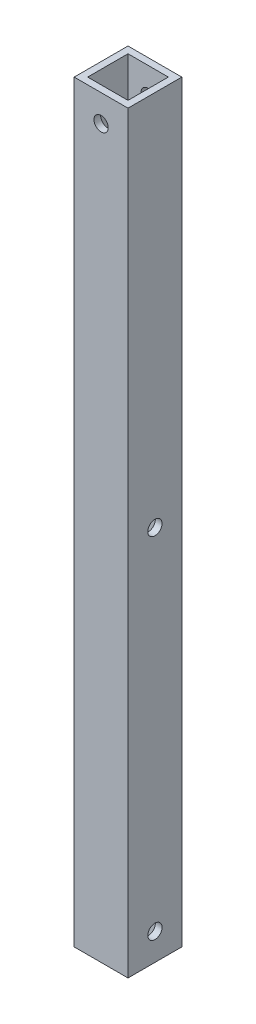
from build123d import *

# Parameters (mm, degrees)
SKETCH1_W           = 25.4
SKETCH1_H           = 25.4
SKETCH1_W_2         = 19.05
SKETCH1_H_2         = 19.05
BOSS_EXTRUDE1_DEPTH = 355.6
CUT_EXTRUDE1_START  = -25.4
SKETCH2_R           = 3.3734375
CUT_EXTRUDE1_DEPTH  = 25.4
CUT_EXTRUDE2_START  = -25.4
SKETCH3_R           = 3.3734375
CUT_EXTRUDE2_DEPTH  = 25.4


with BuildPart() as part:
    # Sketch1 → Boss-Extrude1 (new body)
    with BuildSketch(Plane(origin=(0, 0, 0), x_dir=(1, 0, 0), z_dir=(0, 1, 0))):
        with Locations((12.7, 12.7)):
            Rectangle(SKETCH1_W, SKETCH1_H)
        with Locations((12.7, 12.7)):
            Rectangle(SKETCH1_W_2, SKETCH1_H_2, mode=Mode.SUBTRACT)
    extrude(amount=BOSS_EXTRUDE1_DEPTH)

    # Sketch2 → Cut-Extrude1 (cut)
    with BuildSketch(Plane(origin=(25.4, 0, 0), x_dir=(0, 0, -1), z_dir=(1, 0, 0)).offset(CUT_EXTRUDE1_START)):
        with Locations((12.7, 12.7)):
            Circle(SKETCH2_R)
        with Locations((12.7, 177.8)):
            Circle(SKETCH2_R)
    extrude(amount=CUT_EXTRUDE1_DEPTH, mode=Mode.SUBTRACT)

    # Sketch3 → Cut-Extrude2 (cut)
    with BuildSketch(Plane.XY.offset(CUT_EXTRUDE2_START)):
        with Locations((12.7, 342.9)):
            Circle(SKETCH3_R)
    extrude(amount=CUT_EXTRUDE2_DEPTH, mode=Mode.SUBTRACT)


solid = part.part
